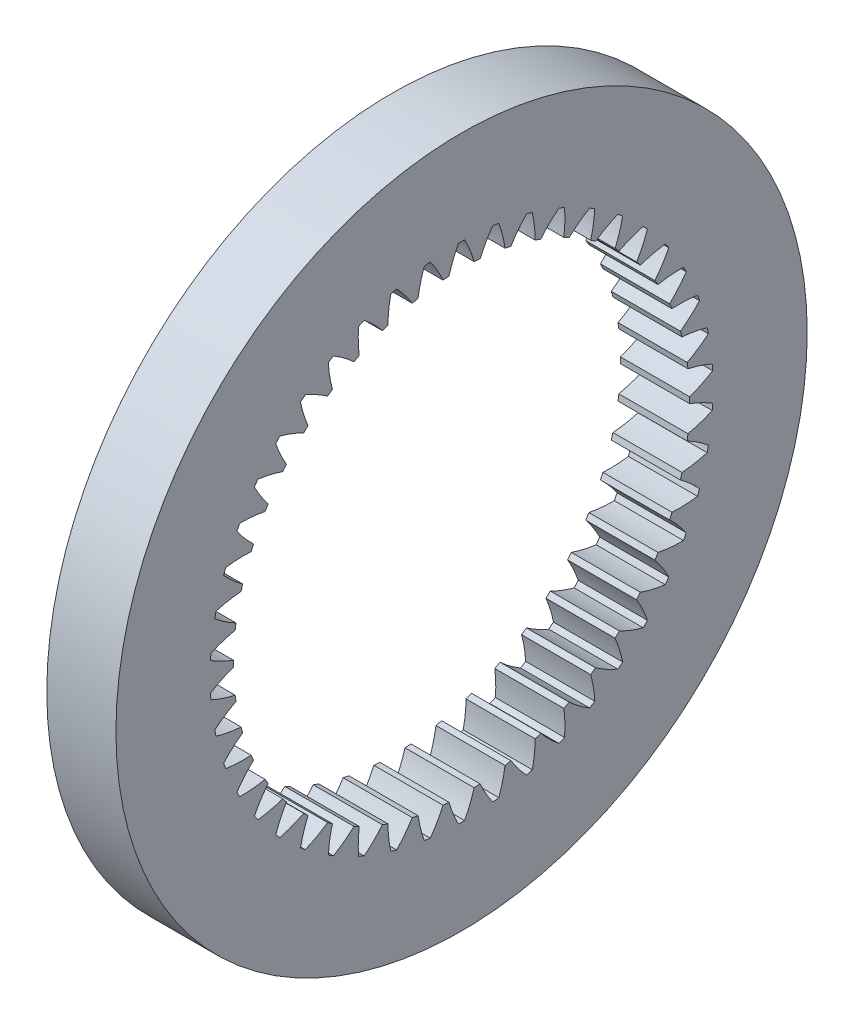
from build123d import *

# Parameters (mm, degrees)
BASPROSKE_W     = 10
BASPROSKE_H     = 17
TOOTHCUT_DEPTH  = 72.414284285
TEETHCUTS_COUNT = 46
TEETHCUTS_ANGLE = 352.173913043


with BuildPart() as part:
    # BasProSke → Base-Revolve (revolve)
    with BuildSketch(Plane(origin=(0, 0, 0), x_dir=(1, 0, 0), z_dir=(0, 1, 0)), mode=Mode.PRIVATE) as base_revolve_sk:
        with Locations((5, 41.5)):
            Rectangle(BASPROSKE_W, BASPROSKE_H)
    revolve(base_revolve_sk.sketch.rotate(Axis((-10, 0, 0), (1, 0, 0)), 180), axis=Axis((-10, 0, 0), (1, 0, 0)))

    # TooCutSke → ToothCut (cut, through all)
    with BuildSketch(Plane(origin=(0, 0, 0), x_dir=(0, 0, -1), z_dir=(1, 0, 0))):
        with BuildLine():
            ThreePointArc((1.829088469, 32.923831498), (1.226862298, 34.686194823), (0.438147788, 36.373361166))
            ThreePointArc((0.438147788, 36.373361166), (0, 36.376), (-0.438147788, 36.373361166))
            ThreePointArc((-0.438147788, 36.373361166), (-1.226862298, 34.686194823), (-1.829088469, 32.923831498))
            ThreePointArc((-1.829088469, 32.923831498), (0, 32.9746), (1.829088469, 32.923831498))
        make_face()
    toothcut = extrude(amount=TOOTHCUT_DEPTH, mode=Mode.SUBTRACT)

    # TeethCuts: ToothCut ×46 about axis
    teethcuts_axis = Axis((-10, 0, 0), (1, 0, 0))
    for i in range(1, TEETHCUTS_COUNT):
        add(toothcut.rotate(teethcuts_axis, i * TEETHCUTS_ANGLE / (TEETHCUTS_COUNT - 1)), mode=Mode.SUBTRACT)


solid = part.part
